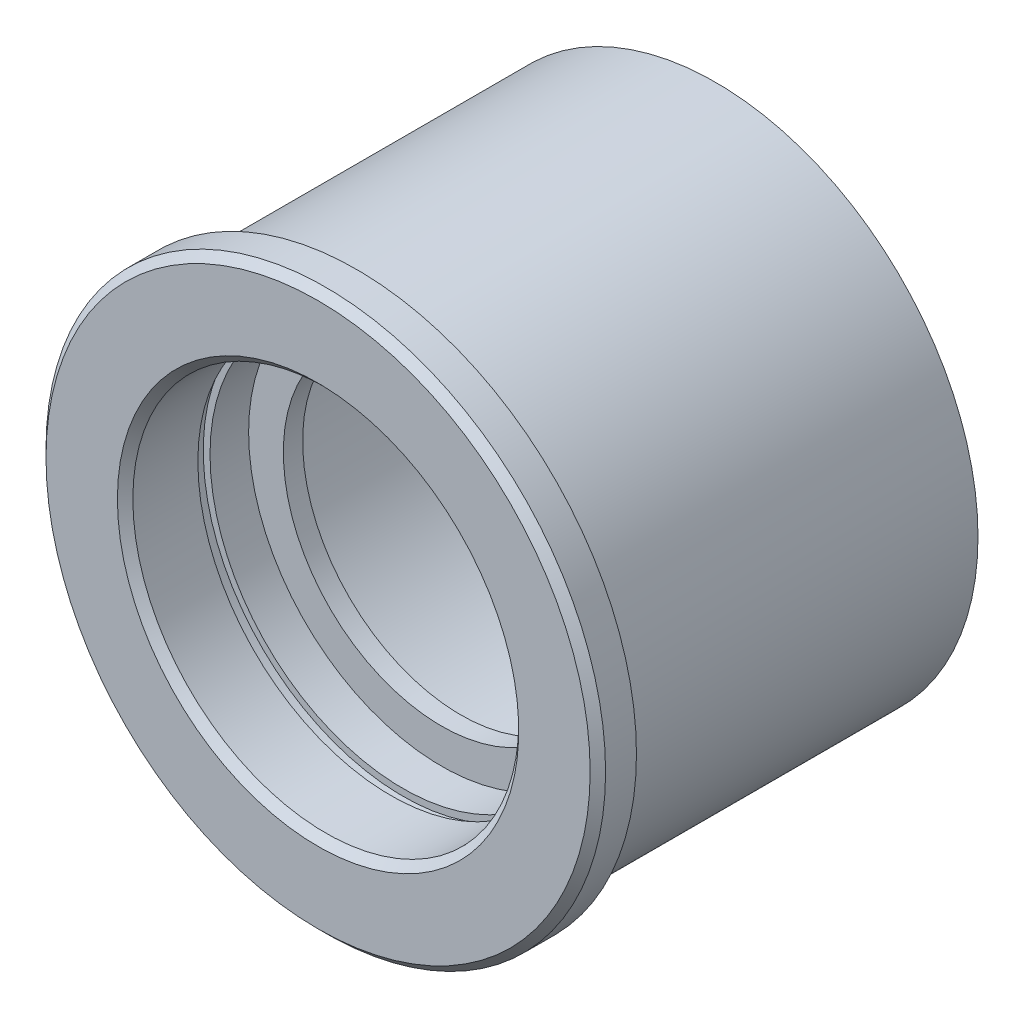
from build123d import *

# Parameters (mm, degrees)
CHAMFER_2_SIZE = 2


with BuildPart() as part:
    # Эскиз1 → Повернуть1 (revolve)
    with BuildSketch(Plane(origin=(0, 0, 0), x_dir=(0, 0, -1), z_dir=(1, 0, 0)), mode=Mode.PRIVATE) as revolve_1_sk:
        Polygon((8.85, 50), (-10, 50), (-10, 72.5), (0, 72.5), (0, 68), (93, 68), (93, 60), (83.15, 60), (83.15, 62), (79, 62), (79, 60), (30, 60), (30, 50), (27, 50), (27, 41), (22, 41), (22, 50), (12, 50), (12, 51.75), (8.85, 51.75), align=None)
    revolve(revolve_1_sk.sketch.rotate(Axis((0, 0, 0), (0, 0, -1)), 90), axis=Axis((0, 0, 0), (0, 0, -1)))

    # Фаска2
    chamfer_2_edges = [part.edges().sort_by_distance(p)[0] for p in [
        (-60, 0, -93),
        (-50, 0, 10),
        (-72.5, 0, 10),
    ]]
    chamfer(chamfer_2_edges, length=CHAMFER_2_SIZE)


solid = part.part
